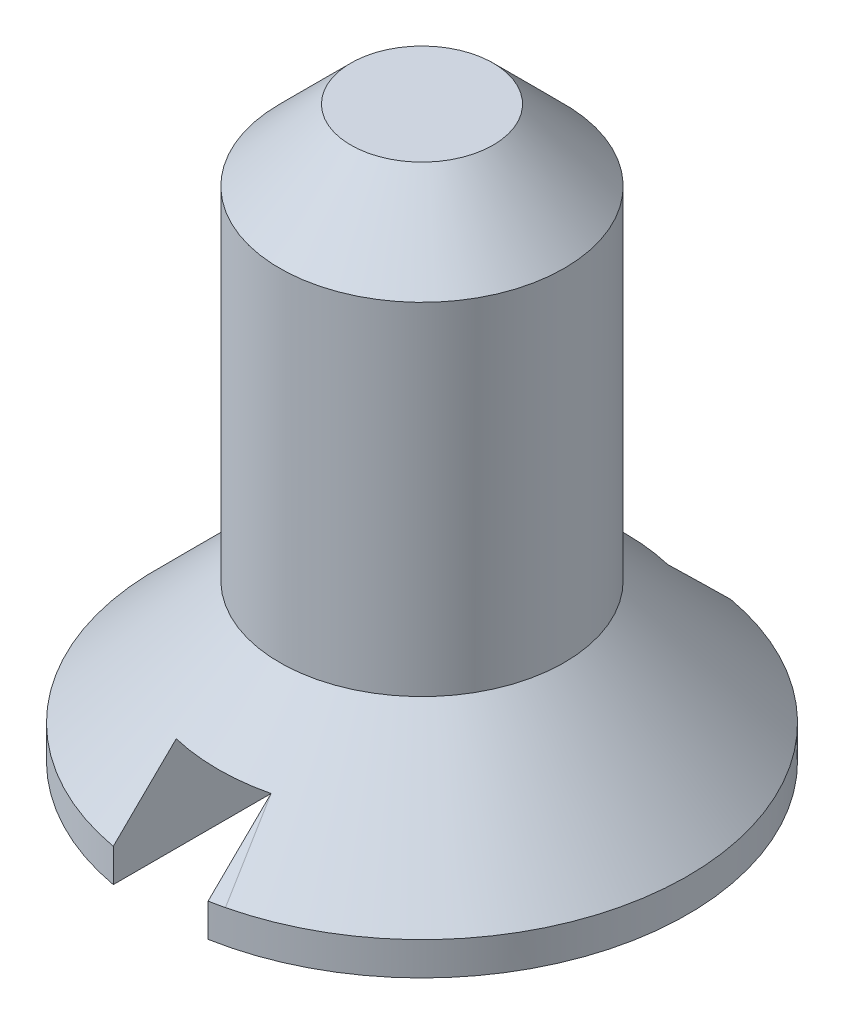
from build123d import *

# Parameters (mm, degrees)
SKETCH_1_W          = 1.5
SKETCH_1_H          = 4.35
SKETCH_2_W          = 1
SKETCH_2_H          = 1
CUT_EXTRUDE_1_DEPTH = 10
CHAMFER_1_SIZE      = 0.75


with BuildPart() as part:
    # Эскиз1 → Повернуть1 (revolve)
    with BuildSketch(Plane.XY):
        with Locations((-0.75, 3.825)):
            Rectangle(SKETCH_1_W, SKETCH_1_H)
        Polygon((-2.8, 0), (0, 0), (0, 1.65), (-1.5, 1.65), (-2.8, 0.35), align=None)
    revolve(axis=Axis((0, 6, 0), (0, -1, 0)))

    # Эскиз2 → Вырез-Вытянуть1 (cut, symmetric)
    with BuildSketch(Plane.XY):
        with Locations((0, 0.5)):
            Rectangle(SKETCH_2_W, SKETCH_2_H)
    extrude(amount=CUT_EXTRUDE_1_DEPTH, both=True, mode=Mode.SUBTRACT)

    # Фаска1
    chamfer_1_edges = [part.edges().sort_by_distance(p)[0] for p in [
        (1.5, 6, 0),
    ]]
    chamfer(chamfer_1_edges, length=CHAMFER_1_SIZE)


solid = part.part
